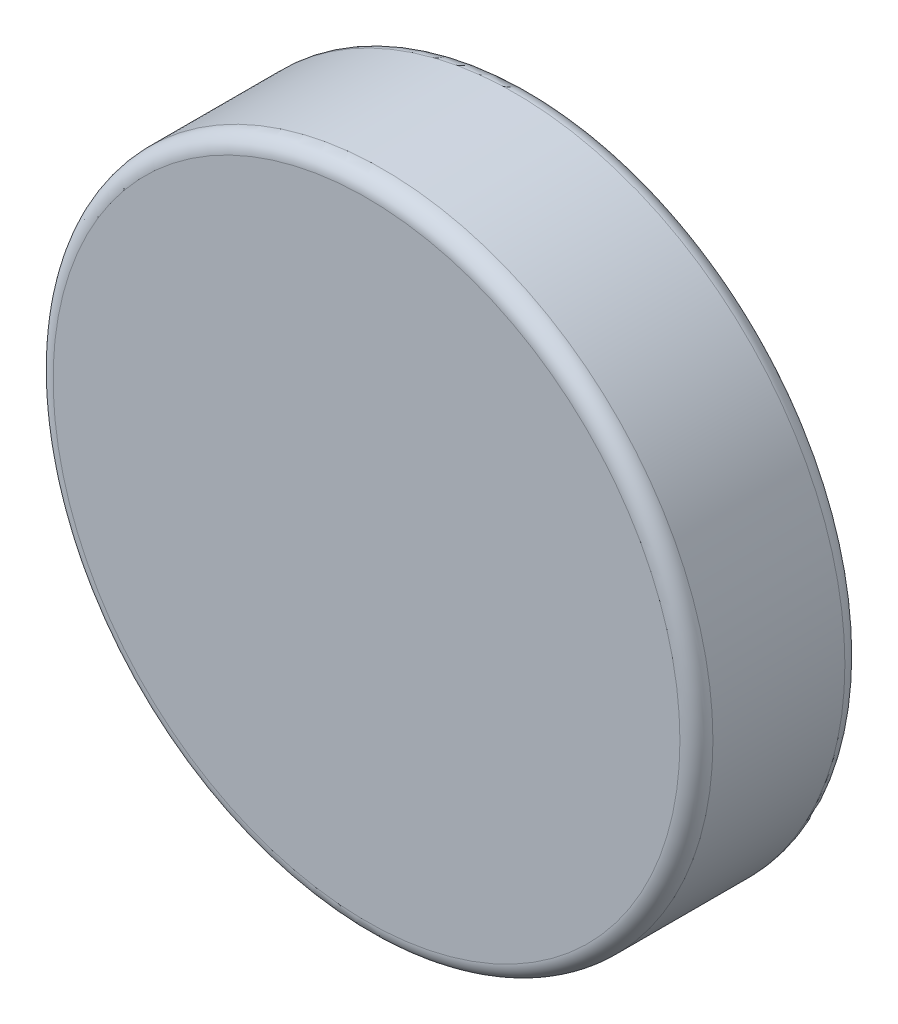
from build123d import *

# Parameters (mm, degrees)
TOP_SKETCH_R            = 3
THICKNESS_EXTRUDE_DEPTH = 1.5
EDGE_FILLET_R           = 0.15


with BuildPart() as part:
    # Top Sketch → Thickness Extrude (new body)
    with BuildSketch(Plane.XY):
        Circle(TOP_SKETCH_R)
    extrude(amount=THICKNESS_EXTRUDE_DEPTH)

    # Edge Fillet
    edge_fillet_edges = [part.edges().sort_by_distance(p)[0] for p in [
        (-3, 0, 0),
        (-3, 0, 1.5),
    ]]
    fillet(edge_fillet_edges, radius=EDGE_FILLET_R)


solid = part.part
